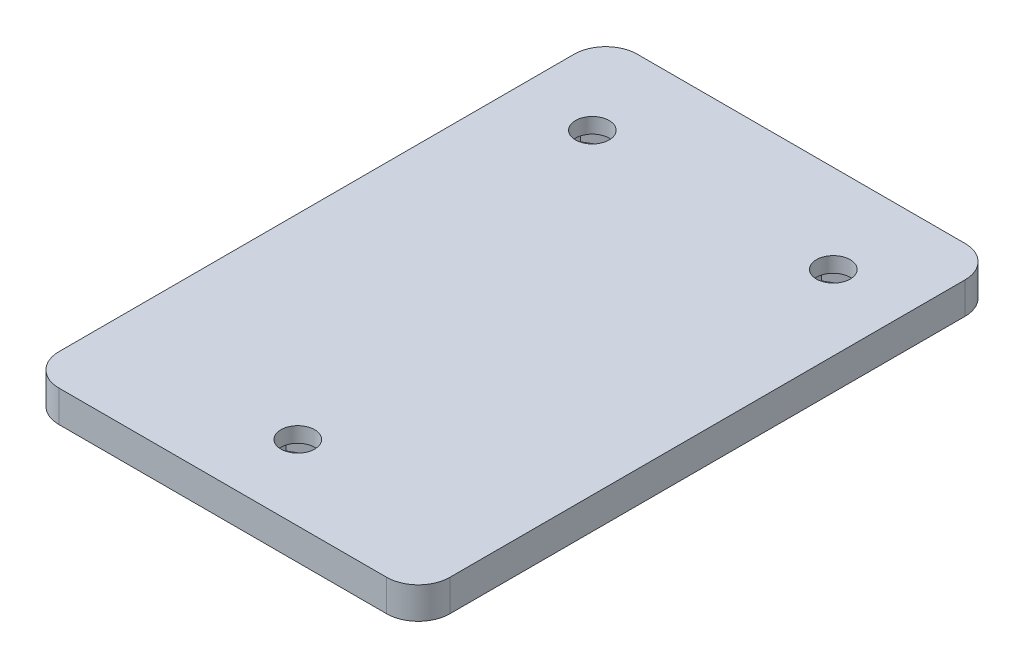
from build123d import *

# Parameters (mm, degrees)
BOSS_EXTRUDE1_DEPTH     = 3
CUT_EXTRUDE4_DEPTH      = 62.713223867
CUT_EXTRUDE4_DEPTH_BACK = 62.713223867
SKETCH2_R               = 1.6
CUT_EXTRUDE8_DEPTH      = 1.55


with BuildPart() as part:
    # Sketch1 → Boss-Extrude1 (new body)
    with BuildSketch(Plane(origin=(0, 0, 0), x_dir=(1, 0, 0), z_dir=(0, 1, 0))):
        with BuildLine():
            Line((-3.3, -0.3), (-3.3, 48.56))
            ThreePointArc((-3.3, 48.56), (-2.421320344, 50.681320344), (-0.3, 51.56))
            Line((-0.3, 51.56), (30.78, 51.56))
            ThreePointArc((30.78, 51.56), (32.901320344, 50.681320344), (33.78, 48.56))
            Line((33.78, 48.56), (33.78, -0.3))
            ThreePointArc((33.78, -0.3), (32.901320344, -2.421320344), (30.78, -3.3))
            Line((30.78, -3.3), (-0.3, -3.3))
            ThreePointArc((-0.3, -3.3), (-2.421320344, -2.421320344), (-3.3, -0.3))
        make_face()
    extrude(amount=BOSS_EXTRUDE1_DEPTH)

    # Sketch2 → Cut-Extrude4 (cut, two sides: drawn at the far end of the back side and taken through both)
    with BuildSketch(Plane(origin=(0, 0, 0), x_dir=(1, 0, 0), z_dir=(0, 1, 0)).offset(-CUT_EXTRUDE4_DEPTH_BACK)):
        with Locations(Location((3.81, 43.18, 0), (0, 0, 270))):
            Circle(SKETCH2_R)
        with Locations(Location((26.67, 43.18, 0), (0, 0, 270))):
            Circle(SKETCH2_R)
        with Locations(Location((15.24, 3.81, 0), (0, 0, 270))):
            Circle(SKETCH2_R)
    extrude(amount=CUT_EXTRUDE4_DEPTH + CUT_EXTRUDE4_DEPTH_BACK, mode=Mode.SUBTRACT)

    # Sketch10 → Cut-Extrude8 (cut)
    with BuildSketch(Plane(origin=(0, 0, 0), x_dir=(-1, 0, 0), z_dir=(0, -1, 0))):
        Polygon((-1.21, 44.6811107), (-3.81, 46.1822214), (-6.41, 44.6811107), (-6.41, 41.6788893), (-3.81, 40.1777786), (-1.21, 41.6788893), align=None)
        Polygon((-24.07, 44.6811107), (-26.67, 46.1822214), (-29.27, 44.6811107), (-29.27, 41.6788893), (-26.67, 40.1777786), (-24.07, 41.6788893), align=None)
        Polygon((-12.64, 5.3111107), (-15.24, 6.8122214), (-17.84, 5.3111107), (-17.84, 2.3088893), (-15.24, 0.8077786), (-12.64, 2.3088893), align=None)
    extrude(amount=-CUT_EXTRUDE8_DEPTH, mode=Mode.SUBTRACT)


solid = part.part
